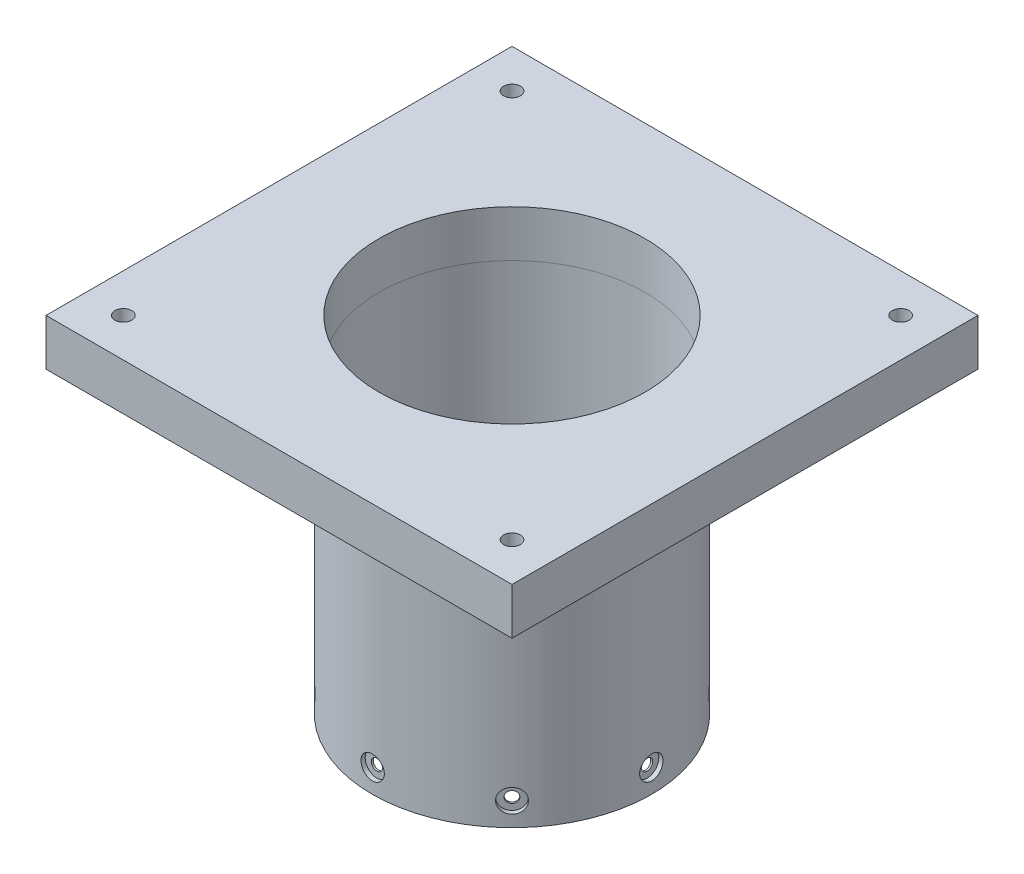
from build123d import *

# Parameters (mm, degrees)
SKETCH_1_R               = 30
SKETCH_1_R_2             = 28.6
EXTRUDE_1_DEPTH          = 64
PATTERN_CIRCULAR_1_COUNT = 8
SKETCH_10_W              = 100
SKETCH_10_H              = 100
SKETCH_10_R              = 1.8
SKETCH_10_R_2            = 28.559863413
EXTRUDE_2_DEPTH          = 10


with BuildPart() as part:
    # 스케치1 → 보스-돌출1 (new body)
    with BuildSketch(Plane(origin=(0, 0, 0), x_dir=(1, 0, 0), z_dir=(0, 1, 0))):
        with Locations(Location((0, 0, 0), (0, 0, 270))):
            Circle(SKETCH_1_R)
        with Locations(Location((0, 0, 0), (0, 0, 270))):
            Circle(SKETCH_1_R_2, mode=Mode.SUBTRACT)
    extrude(amount=EXTRUDE_1_DEPTH)

    # 스케치9 → M2 남비 머리 나사용 카운터보어1 (revolve, cut)
    with BuildSketch(Plane(origin=(-30, 5, 0), x_dir=(0, 0, 1), z_dir=(0, 1, 0))):
        Polygon((0, 0), (0, 10.721032743), (1.2, 10), (1.2, 1), (2.5, 1), (2.5, 0), align=None)
    hole_wizard_m2_1 = revolve(axis=Axis((-36.35, 5, 0), (1, 0, 0)), mode=Mode.SUBTRACT)

    # 원형 패턴1: M2 남비 머리 나사용 카운터보어1 ×8 about axis
    pattern_circular_1_axis = Axis((0, 0, 0), (0, 1, 0))
    for i in range(1, PATTERN_CIRCULAR_1_COUNT):
        add(hole_wizard_m2_1.rotate(pattern_circular_1_axis, i * 360 / PATTERN_CIRCULAR_1_COUNT), mode=Mode.SUBTRACT)

    # 스케치10 → 보스-돌출2 (add)
    with BuildSketch(Plane(origin=(0, 64, 0), x_dir=(1, 0, 0), z_dir=(0, 1, 0))):
        Rectangle(SKETCH_10_W, SKETCH_10_H)
        with Locations(Location((41.7, -41.7, 0), (0, 0, 270))):
            Circle(SKETCH_10_R, mode=Mode.SUBTRACT)
        with Locations(Location((41.7, 41.7, 0), (0, 0, 270))):
            Circle(SKETCH_10_R, mode=Mode.SUBTRACT)
        with Locations(Location((-41.7, 41.7, 0), (0, 0, 270))):
            Circle(SKETCH_10_R, mode=Mode.SUBTRACT)
        with Locations(Location((-41.7, -41.7, 0), (0, 0, 270))):
            Circle(SKETCH_10_R, mode=Mode.SUBTRACT)
        with Locations(Location((0, 0, 0), (0, 0, 270))):
            Circle(SKETCH_10_R_2, mode=Mode.SUBTRACT)
    extrude(amount=EXTRUDE_2_DEPTH)


solid = part.part
